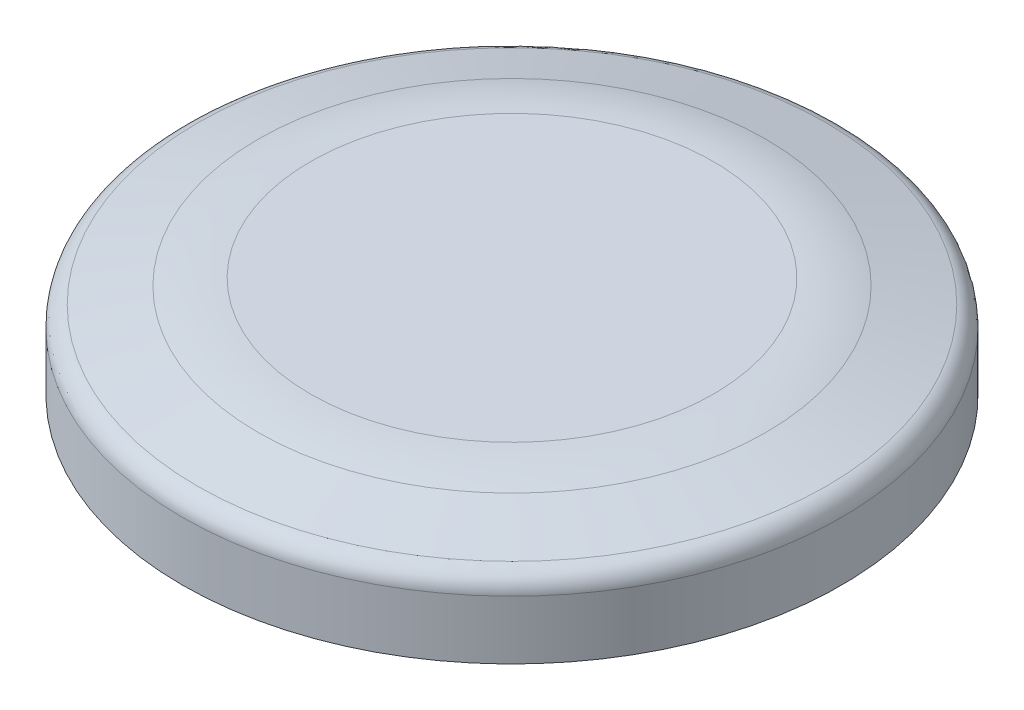
from build123d import *

# Parameters (mm, degrees)
SKETCH1_R           = 3.25
BOSS_EXTRUDE1_DEPTH = 1
CHAMFER1_SIZE       = 1
CHAMFER1_SIZE2      = 0.267949192
FILLET1_R           = 2
FILLET2_R           = 0.2


with BuildPart() as part:
    # Sketch1 → Boss-Extrude1 (new body)
    with BuildSketch(Plane(origin=(0, 0, 0), x_dir=(1, 0, 0), z_dir=(0, 1, 0))):
        with Locations(Location((0, 0, 0), (0, 0, 270))):
            Circle(SKETCH1_R)
    extrude(amount=BOSS_EXTRUDE1_DEPTH)

    # Chamfer1
    chamfer1_edges = [part.edges().sort_by_distance(p)[0] for p in [
        (0, 1, -3.25),
    ]]
    chamfer1_side = [part.faces().sort_by_distance(p)[0] for p in [
        (0, 1, 0),
    ]]
    chamfer(chamfer1_edges, length=CHAMFER1_SIZE, length2=CHAMFER1_SIZE2, reference=chamfer1_side[0])

    # Fillet1
    fillet1_edges = [part.edges().sort_by_distance(p)[0] for p in [
        (0, 1, -2.25),
    ]]
    fillet(fillet1_edges, radius=FILLET1_R)

    # Fillet2
    fillet2_edges = [part.edges().sort_by_distance(p)[0] for p in [
        (0, 0.732050808, -3.25),
    ]]
    fillet(fillet2_edges, radius=FILLET2_R)


solid = part.part
